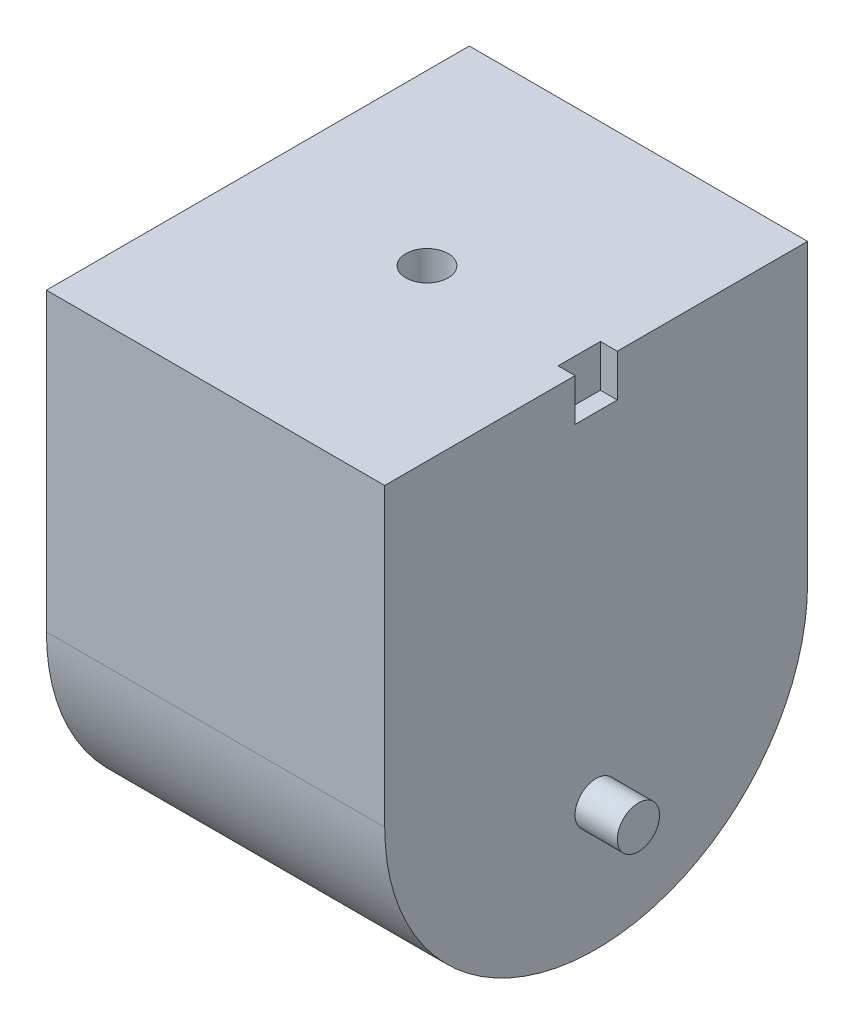
from build123d import *

# Parameters (mm, degrees)
SKETCH1_W           = 50.8
SKETCH1_H           = 76.2
BOSS_EXTRUDE1_DEPTH = 63.5
FILLET2_RADIUS      = 31.75
FILLET2_LENGTH      = 50.8
SKETCH2_R           = 3.175
BOSS_EXTRUDE2_DEPTH = 6.35
SKETCH3_R           = 3.175
CUT_EXTRUDE1_DEPTH  = 6.35
SKETCH4_W           = 6.35
SKETCH4_H           = 6.35
CUT_EXTRUDE2_DEPTH  = 2.54


with BuildPart() as part:
    # Sketch1 → Boss-Extrude1 (new body)
    with BuildSketch(Plane.XY):
        with Locations((25.4, 38.1)):
            Rectangle(SKETCH1_W, SKETCH1_H)
    extrude(amount=BOSS_EXTRUDE1_DEPTH)

    # Fillet2: full round fillet: the end face becomes a half cylinder, R = half its width
    fillet2_face = Plane((25.4, 0, 31.75), x_dir=(1, 0, 0), z_dir=(0, -1, 0))  # on the end face: x along it, z out of the body
    fillet2_slab = fillet2_face.offset(-FILLET2_RADIUS / 2) * Box(FILLET2_LENGTH, 2 * FILLET2_RADIUS, FILLET2_RADIUS, mode=Mode.PRIVATE)  # the body's end, R deep
    fillet2_round = Plane((25.4, 31.75, 31.75), x_dir=(0, -1, 0), z_dir=(1, 0, 0)) * Cylinder(FILLET2_RADIUS, FILLET2_LENGTH, mode=Mode.PRIVATE)  # its axis R under the face
    add(fillet2_slab - fillet2_round, mode=Mode.SUBTRACT)

    # Sketch2 → Boss-Extrude2 (add)
    with BuildSketch(Plane(origin=(50.8, 0, 0), x_dir=(0, 0, -1), z_dir=(1, 0, 0))):
        with Locations(Location((-31.75, 19.05, 0), (0, 0, 180))):
            Circle(SKETCH2_R)
    boss_extrude2 = extrude(amount=BOSS_EXTRUDE2_DEPTH)

    # Mirror1: Boss-Extrude2 across plane
    add(boss_extrude2.mirror(Plane(origin=(25.4, 0, 0), x_dir=(0, 0, 1), z_dir=(1, 0, 0))))

    # Sketch3 → Cut-Extrude1 (cut)
    with BuildSketch(Plane(origin=(0, 76.2, 0), x_dir=(1, 0, 0), z_dir=(0, 1, 0))):
        with Locations(Location((25.4, -31.75, 0), (0, 0, 270))):
            Circle(SKETCH3_R)
    extrude(amount=-CUT_EXTRUDE1_DEPTH, mode=Mode.SUBTRACT)

    # Sketch4 → Cut-Extrude2 (cut)
    with BuildSketch(Plane(origin=(50.8, 0, 0), x_dir=(0, 0, -1), z_dir=(1, 0, 0))):
        with Locations((-31.75, 73.025)):
            Rectangle(SKETCH4_W, SKETCH4_H)
    extrude(amount=-CUT_EXTRUDE2_DEPTH, mode=Mode.SUBTRACT)


solid = part.part
